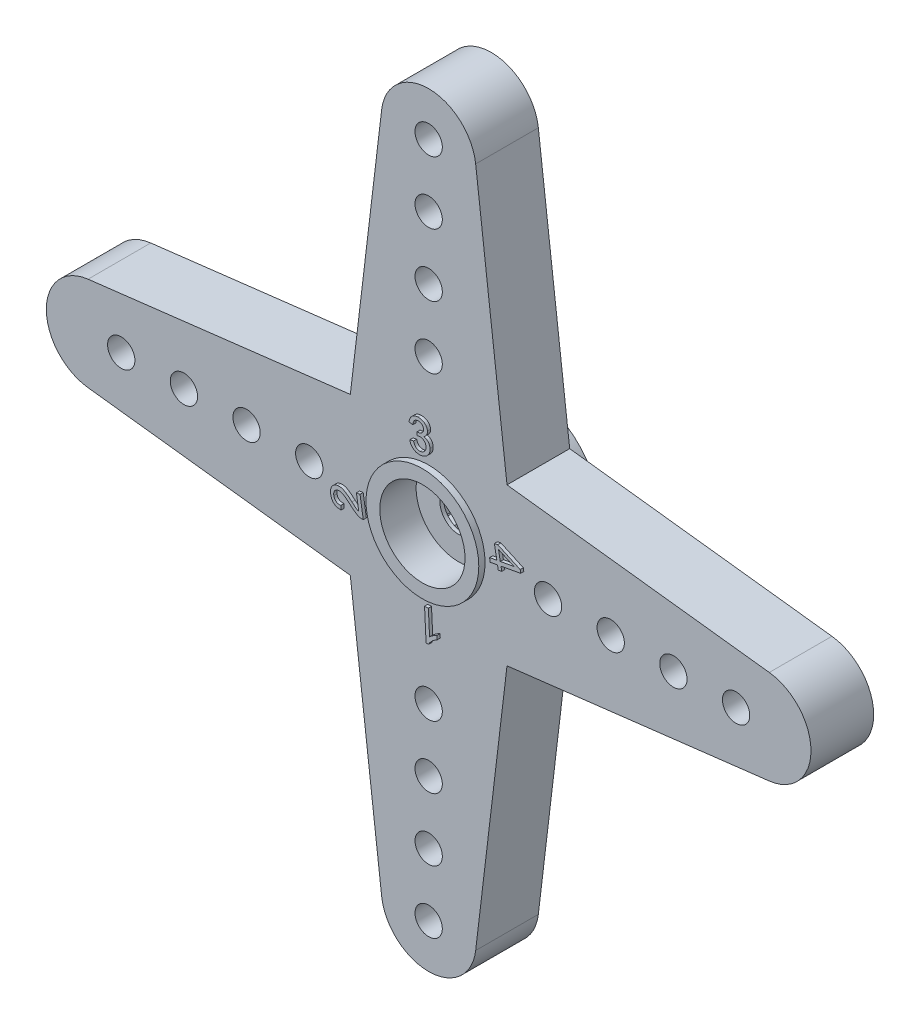
from build123d import *

# Parameters (mm, degrees)
BOSS_EXTRUDE1_DEPTH = 5
CUT_EXTRUDE1_REACH  = 45.422
SKETCH2_R           = 1.5
SKETCH3_R           = 3.4
CUT_EXTRUDE2_DEPTH  = 2.4
BOSS_EXTRUDE2_START = 0.5
SKETCH4_R           = 4.5
SKETCH4_R_2         = 3.4
BOSS_EXTRUDE2_DEPTH = 0.5
CUT_EXTRUDE3_REACH  = 45.422
SKETCH5_R           = 1.09
CIRPATTERN1_COUNT   = 2
SKETCH6_R           = 6
SKETCH6_R_2         = 1.5
BOSS_EXTRUDE3_DEPTH = 2.7
SKETCH7_R           = 3.75
CUT_EXTRUDE4_DEPTH  = 5
BOSS_EXTRUDE4_DEPTH = 5
CIRPATTERN2_COUNT   = 15
BOSS_EXTRUDE5_DEPTH = 0.25
CUT_EXTRUDE7_REACH  = 45.815
SKETCH12_R          = 1.09


with BuildPart() as part:
    # Sketch1 → Boss-Extrude1 (new body)
    with BuildSketch(Plane.XY):
        with BuildLine():
            Line((-3.75, -27.171426985), (-6.25, -6.25))
            Line((-6.25, -6.25), (-27.171426985, -3.75))
            ThreePointArc((-27.171426985, -3.75), (-30.5, 0), (-27.171426985, 3.75))
            Line((-27.171426985, 3.75), (-6.25, 6.25))
            Line((-6.25, 6.25), (-3.75, 27.171426985))
            ThreePointArc((-3.75, 27.171426985), (0, 30.5), (3.75, 27.171426985))
            Line((3.75, 27.171426985), (6.25, 6.25))
            Line((6.25, 6.25), (27.171426985, 3.75))
            ThreePointArc((27.171426985, 3.75), (30.5, 0), (27.171426985, -3.75))
            Line((27.171426985, -3.75), (6.25, -6.25))
            Line((6.25, -6.25), (3.75, -27.171426985))
            ThreePointArc((3.75, -27.171426985), (0, -30.5), (-3.75, -27.171426985))
        make_face()
    extrude(amount=BOSS_EXTRUDE1_DEPTH)

    # Sketch2 → Cut-Extrude1 (cut, up to next)
    with BuildSketch(Plane.XY.offset(5), mode=Mode.PRIVATE) as cut_extrude1_sk1:
        Circle(SKETCH2_R)
    cut_extrude1_tool1 = extrude(cut_extrude1_sk1.sketch, amount=-CUT_EXTRUDE1_REACH, mode=Mode.PRIVATE) & part.part
    add(cut_extrude1_tool1.solids().sort_by_distance((0, 0, 5))[0], mode=Mode.SUBTRACT)

    # Sketch3 → Cut-Extrude2 (cut)
    with BuildSketch(Plane.XY.offset(5)):
        Circle(SKETCH3_R)
    extrude(amount=-CUT_EXTRUDE2_DEPTH, mode=Mode.SUBTRACT)

    # Sketch4 → Boss-Extrude2 (add)
    with BuildSketch(Plane.XY.offset(5).offset(BOSS_EXTRUDE2_START)):
        Circle(SKETCH4_R)
        Circle(SKETCH4_R_2, mode=Mode.SUBTRACT)
    extrude(amount=-BOSS_EXTRUDE2_DEPTH)

    # Sketch5 → Cut-Extrude3 (cut, up to next)
    with BuildSketch(Plane.XY.offset(5), mode=Mode.PRIVATE) as cut_extrude3_sk1:
        with Locations((0, 27)):
            Circle(SKETCH5_R)
    cut_extrude3_tool1 = extrude(cut_extrude3_sk1.sketch, amount=-CUT_EXTRUDE3_REACH, mode=Mode.PRIVATE) & part.part
    # Sketch5 → Cut-Extrude3 (cut, up to next)
    with BuildSketch(Plane.XY.offset(5), mode=Mode.PRIVATE) as cut_extrude3_sk2:
        with Locations((0, 22)):
            Circle(SKETCH5_R)
    cut_extrude3_tool2 = extrude(cut_extrude3_sk2.sketch, amount=-CUT_EXTRUDE3_REACH, mode=Mode.PRIVATE) & part.part
    # Sketch5 → Cut-Extrude3 (cut, up to next)
    with BuildSketch(Plane.XY.offset(5), mode=Mode.PRIVATE) as cut_extrude3_sk3:
        with Locations((0, 17)):
            Circle(SKETCH5_R)
    cut_extrude3_tool3 = extrude(cut_extrude3_sk3.sketch, amount=-CUT_EXTRUDE3_REACH, mode=Mode.PRIVATE) & part.part
    # Sketch5 → Cut-Extrude3 (cut, up to next)
    with BuildSketch(Plane.XY.offset(5), mode=Mode.PRIVATE) as cut_extrude3_sk4:
        with Locations((0, 12)):
            Circle(SKETCH5_R)
    cut_extrude3_tool4 = extrude(cut_extrude3_sk4.sketch, amount=-CUT_EXTRUDE3_REACH, mode=Mode.PRIVATE) & part.part
    cut_extrude3_1 = cut_extrude3_tool1.solids().sort_by_distance((0, 27, 5))[0]
    add(cut_extrude3_1, mode=Mode.SUBTRACT)
    cut_extrude3_2 = cut_extrude3_tool2.solids().sort_by_distance((0, 22, 5))[0]
    add(cut_extrude3_2, mode=Mode.SUBTRACT)
    cut_extrude3_3 = cut_extrude3_tool3.solids().sort_by_distance((0, 17, 5))[0]
    add(cut_extrude3_3, mode=Mode.SUBTRACT)
    cut_extrude3_4 = cut_extrude3_tool4.solids().sort_by_distance((0, 12, 5))[0]
    add(cut_extrude3_4, mode=Mode.SUBTRACT)
    cut_extrude3 = cut_extrude3_1 + cut_extrude3_2 + cut_extrude3_3 + cut_extrude3_4  # Cut-Extrude3 as one shape, for the pattern or mirror that repeats it

    # CirPattern1: Cut-Extrude3 ×2 about axis
    cirpattern1_axis = Axis((0, 0, 0), (0, 0, 1))
    for i in range(1, CIRPATTERN1_COUNT):
        add(cut_extrude3.rotate(cirpattern1_axis, i * 360 / CIRPATTERN1_COUNT), mode=Mode.SUBTRACT)

    # Sketch6 → Boss-Extrude3 (add)
    with BuildSketch(Plane(origin=(0, 0, 0), x_dir=(-1, 0, 0), z_dir=(0, 0, -1))):
        with Locations(Location((0, 0, 0), (0, 0, 180))):
            Circle(SKETCH6_R)
        with Locations(Location((0, 0, 0), (0, 0, 180))):
            Circle(SKETCH6_R_2, mode=Mode.SUBTRACT)
    extrude(amount=BOSS_EXTRUDE3_DEPTH)

    # Sketch7 → Cut-Extrude4 (cut)
    with BuildSketch(Plane(origin=(0, 0, -2.7), x_dir=(-1, 0, 0), z_dir=(0, 0, -1))):
        Circle(SKETCH7_R)
    extrude(amount=-CUT_EXTRUDE4_DEPTH, mode=Mode.SUBTRACT)

    # Sketch8 → Boss-Extrude4 (add)
    with BuildSketch(Plane(origin=(0, 0, -2.7), x_dir=(-1, 0, 0), z_dir=(0, 0, -1))):
        with BuildLine():
            Line((-0.738744308, 3.676514225), (0, 3.25))
            Line((0, 3.25), (0.738744308, 3.676514225))
            ThreePointArc((0.738744308, 3.676514225), (0, 3.75), (-0.738744308, 3.676514225))
        make_face()
    boss_extrude4 = extrude(amount=-BOSS_EXTRUDE4_DEPTH)

    # CirPattern2: Boss-Extrude4 ×15 about axis
    cirpattern2_axis = Axis((0, 0, 0), (0, 0, 1))
    for i in range(1, CIRPATTERN2_COUNT):
        add(boss_extrude4.rotate(cirpattern2_axis, i * 360 / CIRPATTERN2_COUNT))

    # Sketch9 → Boss-Extrude5 (add)
    # profile 1 of 4: a face of its own
    with BuildSketch(Plane.XY.offset(5)):
        Polygon((5.106149594, 0.780498911), (5.688581485, 0.888671988), (5.492768184, 1.94386029), (5.766205684, 1.994441219), (7.548056646, 1.177133527), (7.593128761, 0.933243302), (6.017107126, 0.640775354), (6.078204883, 0.312249713), (5.804767383, 0.261668783), (5.743669626, 0.590194424), (5.161237735, 0.482021347), align=None)
        Polygon((5.962018985, 0.939252918), (7.058773793, 1.142578238), (5.820793024, 1.700971668), align=None, mode=Mode.SUBTRACT)
    # profile 2 of 4: a face of its own
    with BuildSketch(Plane.XY.offset(5)):
        with BuildLine():
            Line((-1.258604507, 5.737523335), (-0.957622936, 5.801625899))
            add(Edge.make_bspline(
                [(-0.957622936, 5.801625899), (-0.95150678, 5.78118641), (-0.939620439, 5.741463629), (-0.918535698, 5.684766036), (-0.895543841, 5.632804733), (-0.871167676, 5.585113317), (-0.843877654, 5.542732055), (-0.815651733, 5.504067001), (-0.784247613, 5.471149091), (-0.751684229, 5.442059812), (-0.716773461, 5.418296171), (-0.680964367, 5.397319149), (-0.643537131, 5.380363455), (-0.604570077, 5.367327955), (-0.564385248, 5.357606178), (-0.522580188, 5.352344458), (-0.479358334, 5.350164089), (-0.450142032, 5.351651092), (-0.435287199, 5.352407149)],
                knots=[0, 0, 0, 0, 1.352609773, 2.628706697, 3.832463828, 4.954562932, 6.020536452, 7.026146561, 7.984692543, 8.899822077, 9.789560014, 10.657431218, 11.52910282, 12.389387989, 13.25977318, 14.146041109, 15.057367045, 16, 16, 16, 16], degree=3))
            add(Edge.make_bspline(
                [(-0.435287199, 5.352407149), (-0.417719396, 5.35428859), (-0.383184954, 5.357987091), (-0.332740039, 5.368417511), (-0.284957909, 5.384073536), (-0.23977201, 5.404260016), (-0.19684381, 5.428328166), (-0.15639455, 5.457218418), (-0.118565608, 5.490698233), (-0.083484614, 5.528244619), (-0.052362264, 5.56898288), (-0.024855186, 5.611860871), (-0.002391262, 5.65686259), (0.015243456, 5.703676839), (0.028001921, 5.752336711), (0.035176248, 5.802899919), (0.038432886, 5.855357906), (0.036798764, 5.890769033), (0.035966807, 5.908797373)],
                knots=[0, 0, 0, 0, 1.042522589, 2.049370494, 3.034035726, 4.004498073, 4.966368309, 5.934276078, 6.932601889, 7.94349183, 8.96241774, 9.954695401, 10.946189968, 11.925317774, 12.902808033, 13.908932437, 14.935405874, 16, 16, 16, 16], degree=3))
            add(Edge.make_bspline(
                [(0.035966807, 5.908797373), (0.034329227, 5.925880556), (0.031109175, 5.959472019), (0.020130462, 6.007945508), (0.006410762, 6.054100482), (-0.012373305, 6.097292865), (-0.034984245, 6.138067808), (-0.061648219, 6.176492025), (-0.092779081, 6.211854611), (-0.1272882, 6.244430223), (-0.164856143, 6.273450316), (-0.20465836, 6.298537815), (-0.246930859, 6.318740865), (-0.290855077, 6.334744924), (-0.336984927, 6.346438076), (-0.384983414, 6.353252545), (-0.435124357, 6.35595485), (-0.469012198, 6.354006182), (-0.48636893, 6.35300811)],
                knots=[0, 0, 0, 0, 1.071112945, 2.106179612, 3.099145003, 4.075541399, 5.041916318, 6.008234959, 6.991292465, 7.979921622, 8.968715793, 9.952602768, 10.913503389, 11.890066867, 12.868966491, 13.880758318, 14.914563221, 16, 16, 16, 16], degree=3))
            add(Edge.make_bspline(
                [(-0.48636893, 6.35300811), (-0.501602604, 6.35144896), (-0.533980783, 6.348135089), (-0.584548029, 6.336893172), (-0.640228145, 6.321959966), (-0.678573871, 6.309152304), (-0.698708673, 6.302427181)],
                knots=[0, 0, 0, 0, 0.839140223, 1.78353772, 2.836166774, 4, 4, 4, 4], degree=3))
            Line((-0.698708673, 6.302427181), (-0.685187039, 6.572859873))
            add(Edge.make_bspline(
                [(-0.685187039, 6.572859873), (-0.676005411, 6.572586191), (-0.659644666, 6.572098516), (-0.643286499, 6.572627677), (-0.636108513, 6.572859873)],
                knots=[0, 0, 0, 0, 1.122397226, 2, 2, 2, 2], degree=3))
            add(Edge.make_bspline(
                [(-0.636108513, 6.572859873), (-0.604548778, 6.576415645), (-0.542334678, 6.583425183), (-0.45298521, 6.610309642), (-0.369328971, 6.648563598), (-0.305395344, 6.690621249), (-0.259158267, 6.729895151), (-0.229843868, 6.763421688), (-0.205542283, 6.799759867), (-0.186372241, 6.839197813), (-0.172341276, 6.881643129), (-0.163229094, 6.927191726), (-0.15984661, 6.975814059), (-0.161502598, 7.009061576), (-0.1623505, 7.026085033)],
                knots=[0, 0, 0, 0, 1.548730187, 3.053031205, 4.534348805, 6.029272029, 6.774885497, 7.491347698, 8.196962285, 8.904459017, 9.626468104, 10.374885394, 11.167905662, 12, 12, 12, 12], degree=3))
            add(Edge.make_bspline(
                [(-0.1623505, 7.026085033), (-0.163753148, 7.039647359), (-0.166527785, 7.066475575), (-0.175232718, 7.105318254), (-0.186653513, 7.142305653), (-0.201776872, 7.177067859), (-0.22044091, 7.20977532), (-0.242404335, 7.240521673), (-0.268489858, 7.268493251), (-0.296632391, 7.295227836), (-0.328125387, 7.318357175), (-0.36112716, 7.338703185), (-0.396390525, 7.354761784), (-0.433164304, 7.367912831), (-0.472023048, 7.376777203), (-0.512404234, 7.382300286), (-0.554647824, 7.384378264), (-0.583361074, 7.382907187), (-0.598047616, 7.382154745)],
                knots=[0, 0, 0, 0, 1.03716262, 2.051655721, 3.024295042, 3.98043995, 4.930909855, 5.886716903, 6.849258626, 7.838362206, 8.837214085, 9.817955429, 10.784515434, 11.781263273, 12.786159818, 13.812365085, 14.881046521, 16, 16, 16, 16], degree=3))
            add(Edge.make_bspline(
                [(-0.598047616, 7.382154745), (-0.612438566, 7.380738922), (-0.640911908, 7.377937635), (-0.682349257, 7.369406111), (-0.721529426, 7.357336768), (-0.75859406, 7.342126926), (-0.793670009, 7.32379321), (-0.826290683, 7.301418354), (-0.857128021, 7.276297363), (-0.885739015, 7.247681826), (-0.911748645, 7.2156284), (-0.934842517, 7.180368235), (-0.955069339, 7.142007173), (-0.971927381, 7.100121152), (-0.986479888, 7.055138659), (-0.997939587, 7.00674075), (-1.006491472, 6.955198447), (-1.009611192, 6.919609281), (-1.011208673, 6.901385514)],
                knots=[0, 0, 0, 0, 0.990887898, 1.960529995, 2.894529938, 3.797802672, 4.703970982, 5.602299816, 6.50499232, 7.427562873, 8.371328578, 9.329966325, 10.31289089, 11.339423522, 12.421611694, 13.551409317, 14.746176093, 16, 16, 16, 16], degree=3))
            Line((-1.011208673, 6.901385514), (-1.320203064, 6.931934392))
            add(Edge.make_bspline(
                [(-1.320203064, 6.931934392), (-1.317105988, 6.957207429), (-1.3110364, 7.006737014), (-1.295180926, 7.078488519), (-1.275257718, 7.146328199), (-1.250771471, 7.21028954), (-1.221180792, 7.270208365), (-1.186279332, 7.325965836), (-1.147394167, 7.378180182), (-1.103636169, 7.426048158), (-1.055404254, 7.468759987), (-1.00443906, 7.507828411), (-0.949136694, 7.5409282), (-0.890891523, 7.569404729), (-0.829021201, 7.592746022), (-0.763714873, 7.610390855), (-0.695180939, 7.624422175), (-0.648022524, 7.628820699), (-0.624089282, 7.631052982)],
                knots=[0, 0, 0, 0, 1.128707139, 2.212017402, 3.254457532, 4.262275816, 5.245649162, 6.213289317, 7.175760811, 8.129479003, 9.083714317, 10.029902467, 10.973305828, 11.936858784, 12.902173627, 13.900867735, 14.934674945, 16, 16, 16, 16], degree=3))
            add(Edge.make_bspline(
                [(-0.624089282, 7.631052982), (-0.590860625, 7.632732031), (-0.525275536, 7.636046054), (-0.427922831, 7.626301672), (-0.333655708, 7.606573142), (-0.243747356, 7.574907709), (-0.160178833, 7.53372067), (-0.084206191, 7.48404971), (-0.018813046, 7.424303556), (0.036838015, 7.357009127), (0.082375051, 7.283996761), (0.117246598, 7.206937598), (0.14107363, 7.126317735), (0.147444023, 7.070969536), (0.150650301, 7.043112277)],
                knots=[0, 0, 0, 0, 1.103958888, 2.178939716, 3.239460843, 4.297077939, 5.336272227, 6.328362846, 7.302022738, 8.267004717, 9.221088753, 10.151888391, 11.069828375, 12, 12, 12, 12], degree=3))
            add(Edge.make_bspline(
                [(0.150650301, 7.043112277), (0.151616202, 7.016876478), (0.153526108, 6.964999667), (0.14238333, 6.888005671), (0.120803887, 6.813743661), (0.087991673, 6.742899045), (0.044653155, 6.676154028), (-0.010001281, 6.615167572), (-0.076019825, 6.560436714), (-0.126022991, 6.530315118), (-0.151833673, 6.514766924)],
                knots=[0, 0, 0, 0, 0.975233816, 1.928358325, 2.879720282, 3.84413286, 4.822723773, 5.830164359, 6.879972175, 8, 8, 8, 8], degree=3))
            add(Edge.make_bspline(
                [(-0.151833673, 6.514766924), (-0.133569099, 6.511757237), (-0.097712666, 6.505848713), (-0.046032882, 6.49153282), (0.002861283, 6.473966499), (0.049229852, 6.452936124), (0.0927145, 6.428023008), (0.133111393, 6.399098414), (0.170758594, 6.366891195), (0.206007607, 6.33152762), (0.237246905, 6.292159816), (0.266174049, 6.250700542), (0.290812024, 6.205865507), (0.311004433, 6.157987958), (0.328973411, 6.107832447), (0.3421835, 6.05443483), (0.35235788, 5.998394246), (0.356086118, 5.959915415), (0.357982032, 5.940347854)],
                knots=[0, 0, 0, 0, 1.060773691, 2.082477289, 3.069561493, 4.037619171, 4.998122876, 5.938380855, 6.882140376, 7.836519456, 8.79625972, 9.760048836, 10.732544787, 11.722964997, 12.73710765, 13.784145124, 14.873175833, 16, 16, 16, 16], degree=3))
            add(Edge.make_bspline(
                [(0.357982032, 5.940347854), (0.359396191, 5.913806722), (0.362191716, 5.861339903), (0.356270718, 5.783614657), (0.343249648, 5.708290678), (0.32277073, 5.635544448), (0.29443531, 5.565425585), (0.258553821, 5.497773332), (0.214887392, 5.432699998), (0.163930379, 5.370935745), (0.107242646, 5.313813753), (0.045958577, 5.262069591), (-0.020424304, 5.218100215), (-0.091192414, 5.180622042), (-0.166468721, 5.150280303), (-0.246003811, 5.12604343), (-0.330047488, 5.108922746), (-0.387810235, 5.103015093), (-0.417258353, 5.100003303)],
                knots=[0, 0, 0, 0, 0.999088643, 1.975010103, 2.924940547, 3.871314082, 4.812484222, 5.76490281, 6.747330016, 7.755732081, 8.77272258, 9.771455837, 10.767816614, 11.762354658, 12.779345157, 13.816441046, 14.886796338, 16, 16, 16, 16], degree=3))
            add(Edge.make_bspline(
                [(-0.417258353, 5.100003303), (-0.443959821, 5.098579464), (-0.496362885, 5.095785106), (-0.573785222, 5.098859464), (-0.648074666, 5.108187838), (-0.719483486, 5.124443499), (-0.787894876, 5.146893833), (-0.853589961, 5.175533508), (-0.915788306, 5.210918068), (-0.974881833, 5.251692322), (-1.029144358, 5.29842631), (-1.079091295, 5.348778836), (-1.122708358, 5.404016642), (-1.161675683, 5.462523284), (-1.19404864, 5.525763119), (-1.221908621, 5.592408421), (-1.243404611, 5.663485059), (-1.253479672, 5.712560404), (-1.258604507, 5.737523335)],
                knots=[0, 0, 0, 0, 1.099796236, 2.158409156, 3.183349168, 4.176493077, 5.166996812, 6.142017535, 7.120106229, 8.107126549, 9.091322496, 10.062780004, 11.020738957, 11.982826215, 12.950585514, 13.939182049, 14.951733174, 16, 16, 16, 16], degree=3))
        make_face()
    # profile 3 of 4: a face of its own
    with BuildSketch(Plane.XY.offset(5)):
        with BuildLine():
            Line((-5.513036068, -0.059684942), (-5.223572927, -0.014112025))
            Line((-5.223572927, -0.014112025), (-4.969165876, -1.636708179))
            add(Edge.make_bspline(
                [(-4.969165876, -1.636708179), (-4.987152957, -1.639601701), (-5.02280347, -1.645336681), (-5.077046117, -1.647054361), (-5.13107945, -1.643755124), (-5.166693774, -1.637388954), (-5.184510427, -1.634204173)],
                knots=[0, 0, 0, 0, 1.008012081, 1.997886505, 2.998409663, 4, 4, 4, 4], degree=3))
            add(Edge.make_bspline(
                [(-5.184510427, -1.634204173), (-5.214088367, -1.627354899), (-5.274367029, -1.613396352), (-5.363073456, -1.579310575), (-5.453679226, -1.538822737), (-5.528464914, -1.495920191), (-5.589849776, -1.457052825), (-5.638438718, -1.423728559), (-5.689649697, -1.387373228), (-5.742355817, -1.346609782), (-5.797865333, -1.303009438), (-5.855008868, -1.255407301), (-5.914988527, -1.204924506), (-5.954837377, -1.169235597), (-5.975275651, -1.150930935)],
                knots=[0, 0, 0, 0, 1.164549845, 2.373306188, 3.641297148, 4.973162756, 5.679195646, 6.431307857, 7.235389789, 8.090590261, 8.989644043, 9.945867823, 10.946445942, 12, 12, 12, 12], degree=3))
            add(Edge.make_bspline(
                [(-5.975275651, -1.150930935), (-6.006891306, -1.122936539), (-6.067680424, -1.069110208), (-6.157194739, -0.993160928), (-6.241095555, -0.924818424), (-6.319182502, -0.863176639), (-6.392414871, -0.809988608), (-6.45920128, -0.762683606), (-6.52145694, -0.724411622), (-6.578186859, -0.692020966), (-6.631730996, -0.665946498), (-6.68335138, -0.644954792), (-6.733507585, -0.627880818), (-6.782050047, -0.614407524), (-6.829579682, -0.606521146), (-6.875613635, -0.602499617), (-6.920602045, -0.602041707), (-6.949857672, -0.605732305), (-6.964358184, -0.607561544)],
                knots=[0, 0, 0, 0, 1.746090021, 3.357301125, 4.853642051, 6.220639687, 7.470090186, 8.595979249, 9.603501712, 10.490508533, 11.296254538, 12.064060491, 12.793128802, 13.486318213, 14.144496699, 14.781934133, 15.396267318, 16, 16, 16, 16], degree=3))
            add(Edge.make_bspline(
                [(-6.964358184, -0.607561544), (-6.978949568, -0.610278992), (-7.00762053, -0.615618569), (-7.048967727, -0.628472839), (-7.088245238, -0.644288316), (-7.125038866, -0.664480022), (-7.159178155, -0.688662249), (-7.19087051, -0.716525843), (-7.220685537, -0.747617479), (-7.247373225, -0.782471795), (-7.271000703, -0.81996197), (-7.290524073, -0.859765991), (-7.306375222, -0.901227821), (-7.316536661, -0.945087328), (-7.323827502, -0.990258684), (-7.326004834, -1.037561371), (-7.324827299, -1.086519758), (-7.320252997, -1.119576248), (-7.317923889, -1.136407698)],
                knots=[0, 0, 0, 0, 0.999861432, 1.964651645, 2.913490531, 3.850305984, 4.787053833, 5.728253098, 6.69146664, 7.686439056, 8.682556508, 9.674085881, 10.671220039, 11.667528202, 12.7037193, 13.751881453, 14.855320216, 16, 16, 16, 16], degree=3))
            add(Edge.make_bspline(
                [(-7.317923889, -1.136407698), (-7.31470169, -1.153998759), (-7.308383556, -1.188491562), (-7.294344586, -1.237937139), (-7.276848881, -1.284183436), (-7.254959709, -1.326618633), (-7.230768629, -1.366864835), (-7.201334041, -1.402602558), (-7.169187548, -1.43572916), (-7.133076186, -1.464636083), (-7.093873403, -1.489611929), (-7.052323809, -1.511028258), (-7.007725532, -1.526755657), (-6.961075073, -1.539127384), (-6.911643193, -1.545912262), (-6.859887272, -1.548128913), (-6.80556664, -1.547043153), (-6.76884714, -1.542091981), (-6.750015235, -1.53955273)],
                knots=[0, 0, 0, 0, 1.090511337, 2.138290234, 3.131230496, 4.101346354, 5.048087707, 5.989666076, 6.918658082, 7.860236451, 8.803795471, 9.751139164, 10.704757266, 11.682911645, 12.691089733, 13.741291015, 14.841602025, 16, 16, 16, 16], degree=3))
            Line((-6.750015235, -1.53955273), (-6.732987991, -1.854556737))
            add(Edge.make_bspline(
                [(-6.732987991, -1.854556737), (-6.761531368, -1.855876446), (-6.817303873, -1.8584551), (-6.89902542, -1.854095178), (-6.976516234, -1.844512499), (-7.049559769, -1.827753497), (-7.118625333, -1.805338704), (-7.183532319, -1.776276938), (-7.243870223, -1.740470126), (-7.299822489, -1.698709016), (-7.350821738, -1.650997127), (-7.397283503, -1.59810259), (-7.438516428, -1.539649942), (-7.47449712, -1.475558956), (-7.50624499, -1.406513621), (-7.531931486, -1.331715625), (-7.553937561, -1.252204398), (-7.563460141, -1.196774205), (-7.56832453, -1.16845898)],
                knots=[0, 0, 0, 0, 1.133749327, 2.215296341, 3.244468421, 4.229996519, 5.185658652, 6.123014808, 7.047063078, 7.965605124, 8.889368164, 9.814556472, 10.75600361, 11.723518484, 12.728879352, 13.768496698, 14.860088474, 16, 16, 16, 16], degree=3))
            add(Edge.make_bspline(
                [(-7.56832453, -1.16845898), (-7.572304405, -1.139628291), (-7.580055843, -1.083475943), (-7.583507051, -1.000343939), (-7.579991985, -0.920950658), (-7.570322539, -0.845072302), (-7.553038731, -0.773004595), (-7.52959241, -0.704395927), (-7.498811347, -0.639421596), (-7.46140596, -0.578536984), (-7.418161385, -0.522890672), (-7.371877726, -0.471550519), (-7.320139955, -0.42769959), (-7.265624157, -0.388495215), (-7.206305793, -0.35658742), (-7.14361933, -0.32970213), (-7.076483101, -0.309678165), (-7.030055253, -0.300987248), (-7.006425491, -0.296563948)],
                knots=[0, 0, 0, 0, 1.199113079, 2.335463199, 3.423693052, 4.471764997, 5.483146204, 6.473237771, 7.455094137, 8.440488303, 9.412116973, 10.356815898, 11.283756977, 12.202025513, 13.119649334, 14.053865838, 15.009502055, 16, 16, 16, 16], degree=3))
            add(Edge.make_bspline(
                [(-7.006425491, -0.296563948), (-6.981759163, -0.293601159), (-6.932551665, -0.287690614), (-6.857612885, -0.287037432), (-6.782414389, -0.295702186), (-6.705716523, -0.310402159), (-6.627462161, -0.335344288), (-6.545765031, -0.368370094), (-6.461529488, -0.412556383), (-6.389036134, -0.456216072), (-6.327247905, -0.496855081), (-6.275656635, -0.533685162), (-6.219508225, -0.575578962), (-6.158340173, -0.622371212), (-6.093324907, -0.674997969), (-6.022874847, -0.732014996), (-5.948303556, -0.79469188), (-5.89742891, -0.838700169), (-5.871108985, -0.861467794)],
                knots=[0, 0, 0, 0, 0.909637808, 1.814660018, 2.73709459, 3.678487545, 4.670700266, 5.740366587, 6.902675557, 8.150619598, 8.839188231, 9.611165513, 10.47214778, 11.405342672, 12.431949935, 13.535951689, 14.725228135, 16, 16, 16, 16], degree=3))
            add(Edge.make_bspline(
                [(-5.871108985, -0.861467794), (-5.849569442, -0.880158264), (-5.80836418, -0.915913233), (-5.749432614, -0.967215326), (-5.695427776, -1.012496233), (-5.647174824, -1.052715675), (-5.604781428, -1.087824039), (-5.56773183, -1.117392554), (-5.536274118, -1.141584302), (-5.487125616, -1.176407172), (-5.418695934, -1.219883745), (-5.354951352, -1.249391816), (-5.324233985, -1.263611224)],
                knots=[0, 0, 0, 0, 1.255036833, 2.400892262, 3.438405492, 4.35644532, 5.165387529, 5.860664605, 6.44251893, 6.91136883, 8.511644238, 10, 10, 10, 10], degree=3))
            Line((-5.324233985, -1.263611224), (-5.513036068, -0.059684942))
        make_face()
    # profile 4 of 4: a face of its own
    with BuildSketch(Plane.XY.offset(5)):
        with BuildLine():
            Line((-0.077454194, -5.171260269), (0.226532184, -5.156236231))
            Line((0.226532184, -5.156236231), (0.321684428, -7.094837993))
            add(Edge.make_bspline(
                [(0.321684428, -7.094837993), (0.340305104, -7.076215847), (0.379110085, -7.037407801), (0.444781157, -6.981971717), (0.518934972, -6.926193967), (0.599400099, -6.870868937), (0.681837312, -6.81871055), (0.762038228, -6.771823158), (0.838092325, -6.732031796), (0.888150931, -6.709497952), (0.91212914, -6.698704179)],
                knots=[0, 0, 0, 0, 0.883906006, 1.842036055, 2.882336849, 3.998636151, 5.11977964, 6.157071265, 7.117232086, 8, 8, 8, 8], degree=3))
            Line((0.91212914, -6.698704179), (0.926151576, -6.992674532))
            add(Edge.make_bspline(
                [(0.926151576, -6.992674532), (0.885749716, -7.015146808), (0.806005733, -7.059501913), (0.693748056, -7.134966188), (0.589644661, -7.216306972), (0.494929889, -7.302416797), (0.411767395, -7.390785822), (0.340132513, -7.477417552), (0.282688924, -7.562913482), (0.253823391, -7.621688621), (0.240053819, -7.649725814)],
                knots=[0, 0, 0, 0, 1.149026113, 2.267913364, 3.358870889, 4.431227475, 5.447085996, 6.373380503, 7.224062336, 8, 8, 8, 8], degree=3))
            Line((0.240053819, -7.649725814), (0.044240518, -7.659241038))
            Line((0.044240518, -7.659241038), (-0.077454194, -5.171260269))
        make_face()
    extrude(amount=BOSS_EXTRUDE5_DEPTH)

    # Sketch12 → Cut-Extrude7 (cut, up to next)
    with BuildSketch(Plane.XY.offset(5), mode=Mode.PRIVATE) as cut_extrude7_sk1:
        with Locations((9.525, 0)):
            Circle(SKETCH12_R)
    cut_extrude7_tool1 = extrude(cut_extrude7_sk1.sketch, amount=-CUT_EXTRUDE7_REACH, mode=Mode.PRIVATE) & part.part
    # Sketch12 → Cut-Extrude7 (cut, up to next)
    with BuildSketch(Plane.XY.offset(5), mode=Mode.PRIVATE) as cut_extrude7_sk2:
        with Locations((-9.525, 0)):
            Circle(SKETCH12_R)
    cut_extrude7_tool2 = extrude(cut_extrude7_sk2.sketch, amount=-CUT_EXTRUDE7_REACH, mode=Mode.PRIVATE) & part.part
    # Sketch12 → Cut-Extrude7 (cut, up to next)
    with BuildSketch(Plane.XY.offset(5), mode=Mode.PRIVATE) as cut_extrude7_sk3:
        with Locations((14.525, 0)):
            Circle(SKETCH12_R)
    cut_extrude7_tool3 = extrude(cut_extrude7_sk3.sketch, amount=-CUT_EXTRUDE7_REACH, mode=Mode.PRIVATE) & part.part
    # Sketch12 → Cut-Extrude7 (cut, up to next)
    with BuildSketch(Plane.XY.offset(5), mode=Mode.PRIVATE) as cut_extrude7_sk4:
        with Locations((19.525, 0)):
            Circle(SKETCH12_R)
    cut_extrude7_tool4 = extrude(cut_extrude7_sk4.sketch, amount=-CUT_EXTRUDE7_REACH, mode=Mode.PRIVATE) & part.part
    # Sketch12 → Cut-Extrude7 (cut, up to next)
    with BuildSketch(Plane.XY.offset(5), mode=Mode.PRIVATE) as cut_extrude7_sk5:
        with Locations((24.525, 0)):
            Circle(SKETCH12_R)
    cut_extrude7_tool5 = extrude(cut_extrude7_sk5.sketch, amount=-CUT_EXTRUDE7_REACH, mode=Mode.PRIVATE) & part.part
    # Sketch12 → Cut-Extrude7 (cut, up to next)
    with BuildSketch(Plane.XY.offset(5), mode=Mode.PRIVATE) as cut_extrude7_sk6:
        with Locations((-14.525, 0)):
            Circle(SKETCH12_R)
    cut_extrude7_tool6 = extrude(cut_extrude7_sk6.sketch, amount=-CUT_EXTRUDE7_REACH, mode=Mode.PRIVATE) & part.part
    # Sketch12 → Cut-Extrude7 (cut, up to next)
    with BuildSketch(Plane.XY.offset(5), mode=Mode.PRIVATE) as cut_extrude7_sk7:
        with Locations((-19.525, 0)):
            Circle(SKETCH12_R)
    cut_extrude7_tool7 = extrude(cut_extrude7_sk7.sketch, amount=-CUT_EXTRUDE7_REACH, mode=Mode.PRIVATE) & part.part
    # Sketch12 → Cut-Extrude7 (cut, up to next)
    with BuildSketch(Plane.XY.offset(5), mode=Mode.PRIVATE) as cut_extrude7_sk8:
        with Locations((-24.525, 0)):
            Circle(SKETCH12_R)
    cut_extrude7_tool8 = extrude(cut_extrude7_sk8.sketch, amount=-CUT_EXTRUDE7_REACH, mode=Mode.PRIVATE) & part.part
    add(cut_extrude7_tool1.solids().sort_by_distance((9.525, 0, 5))[0], mode=Mode.SUBTRACT)
    add(cut_extrude7_tool2.solids().sort_by_distance((-9.525, 0, 5))[0], mode=Mode.SUBTRACT)
    add(cut_extrude7_tool3.solids().sort_by_distance((14.525, 0, 5))[0], mode=Mode.SUBTRACT)
    add(cut_extrude7_tool4.solids().sort_by_distance((19.525, 0, 5))[0], mode=Mode.SUBTRACT)
    add(cut_extrude7_tool5.solids().sort_by_distance((24.525, 0, 5))[0], mode=Mode.SUBTRACT)
    add(cut_extrude7_tool6.solids().sort_by_distance((-14.525, 0, 5))[0], mode=Mode.SUBTRACT)
    add(cut_extrude7_tool7.solids().sort_by_distance((-19.525, 0, 5))[0], mode=Mode.SUBTRACT)
    add(cut_extrude7_tool8.solids().sort_by_distance((-24.525, 0, 5))[0], mode=Mode.SUBTRACT)


solid = part.part
